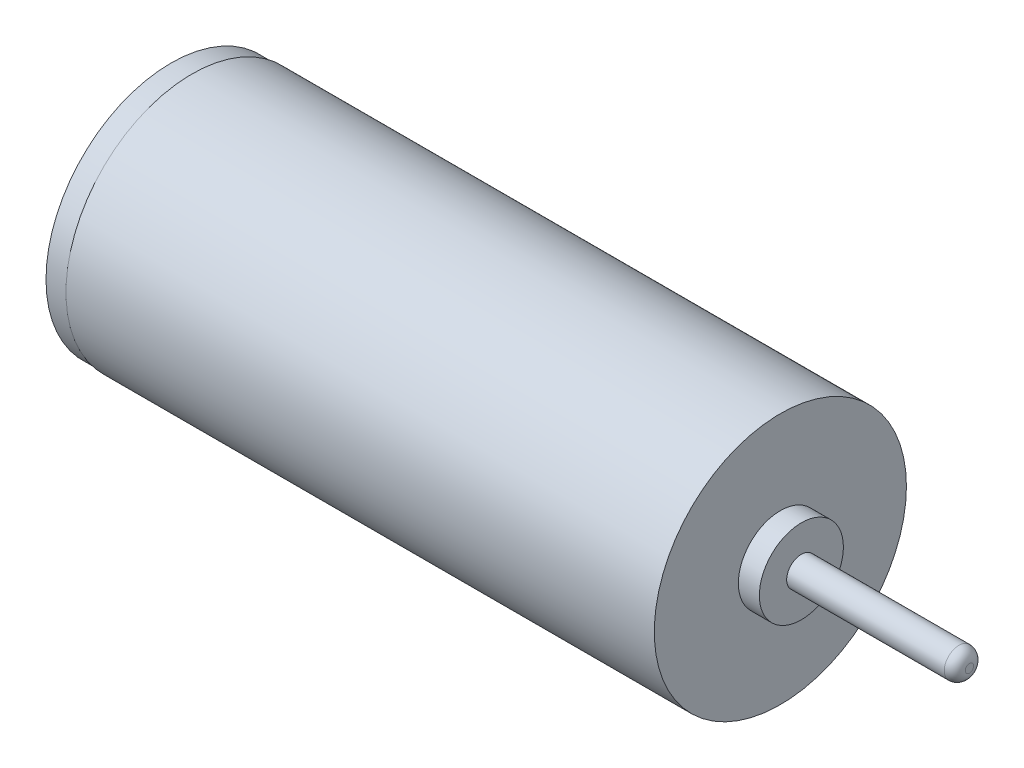
from build123d import *

# Parameters (mm, degrees)
SKETCH1_R           = 3
BOSS_EXTRUDE1_DEPTH = 14
SKETCH2_R           = 1
BOSS_EXTRUDE2_DEPTH = 0.5
SKETCH3_R           = 0.35
BOSS_EXTRUDE3_DEPTH = 4
FILLET1_R           = 0.25
SKETCH7_R           = 2.975
BOSS_EXTRUDE6_DEPTH = 0.5
BOSS_EXTRUDE7_START = 1
SKETCH8_R           = 1
BOSS_EXTRUDE7_DEPTH = 1


with BuildPart() as part:
    # Sketch1 → Boss-Extrude1 (new body)
    with BuildSketch(Plane(origin=(0, 0, 0), x_dir=(0, 0, -1), z_dir=(1, 0, 0))):
        Circle(SKETCH1_R)
    extrude(amount=-BOSS_EXTRUDE1_DEPTH)

    # Sketch2 → Boss-Extrude2 (add)
    with BuildSketch(Plane(origin=(0, 0, 0), x_dir=(0, 0, -1), z_dir=(1, 0, 0))):
        Circle(SKETCH2_R)
    extrude(amount=BOSS_EXTRUDE2_DEPTH)

    # Sketch3 → Boss-Extrude3 (add)
    with BuildSketch(Plane(origin=(0.5, 0, 0), x_dir=(0, 0, -1), z_dir=(1, 0, 0))):
        Circle(SKETCH3_R)
    extrude(amount=BOSS_EXTRUDE3_DEPTH)

    # Fillet1
    fillet1_edges = [part.edges().sort_by_distance(p)[0] for p in [
        (4.5, 0, 0.35),
    ]]
    fillet(fillet1_edges, radius=FILLET1_R)

    # Sketch7 → Boss-Extrude6 (add)
    with BuildSketch(Plane.ZY.offset(14)):
        with Locations(Location((0, 0, 0), (0, 0, 180))):
            Circle(SKETCH7_R)
    extrude(amount=BOSS_EXTRUDE6_DEPTH)

    # Sketch8 → Boss-Extrude7 (add)
    with BuildSketch(Plane.ZY.offset(14.5).offset(BOSS_EXTRUDE7_START)):
        with Locations(Location((0, 0, 0), (0, 0, 180))):
            Circle(SKETCH8_R)
    extrude(amount=-BOSS_EXTRUDE7_DEPTH)


solid = part.part
